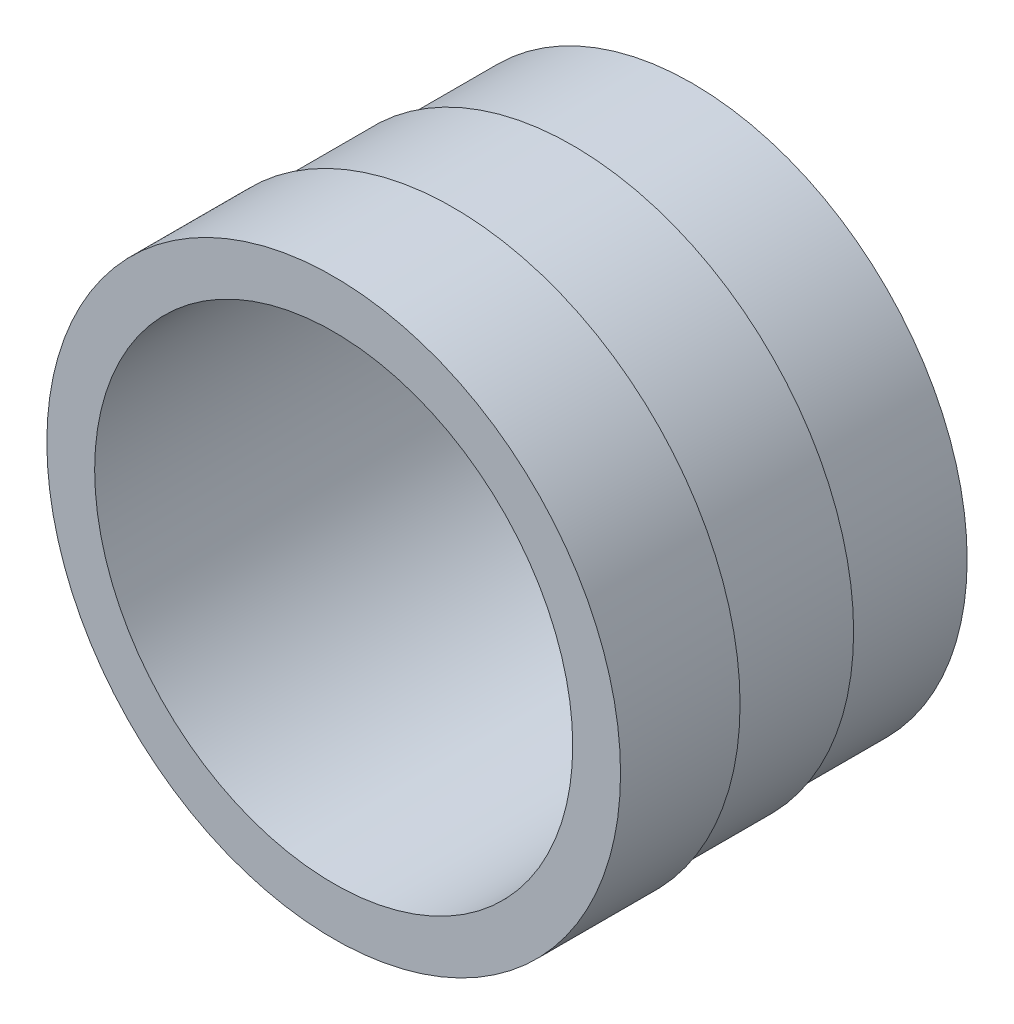
from build123d import *

# Parameters (mm, degrees)
SKETCH3_R          = 25.4
CUT_EXTRUDE2_DEPTH = 58.529738397


with BuildPart() as part:
    # Sketch1 → Revolve1 (revolve)
    with BuildSketch(Plane(origin=(0, 0, 0), x_dir=(1, 0, 0), z_dir=(0, 1, 0)), mode=Mode.PRIVATE) as revolve1_sk:
        Polygon((0, 0), (0, 38.1), (-29.21, 38.1), (-29.21, 25.4), (-29.845, 25.4), (-29.845, 12.7), (-30.48, 12.7), (-30.48, 0), align=None)
    revolve(revolve1_sk.sketch.rotate(Axis((0, 0, 0), (0, 0, -1)), 180), axis=Axis((0, 0, 0), (0, 0, -1)))

    # Sketch3 → Cut-Extrude2 (cut, through all)
    with BuildSketch(Plane(origin=(0, 0, -38.1), x_dir=(-1, 0, 0), z_dir=(0, 0, -1))):
        Circle(SKETCH3_R)
    extrude(amount=-CUT_EXTRUDE2_DEPTH, mode=Mode.SUBTRACT)


solid = part.part
